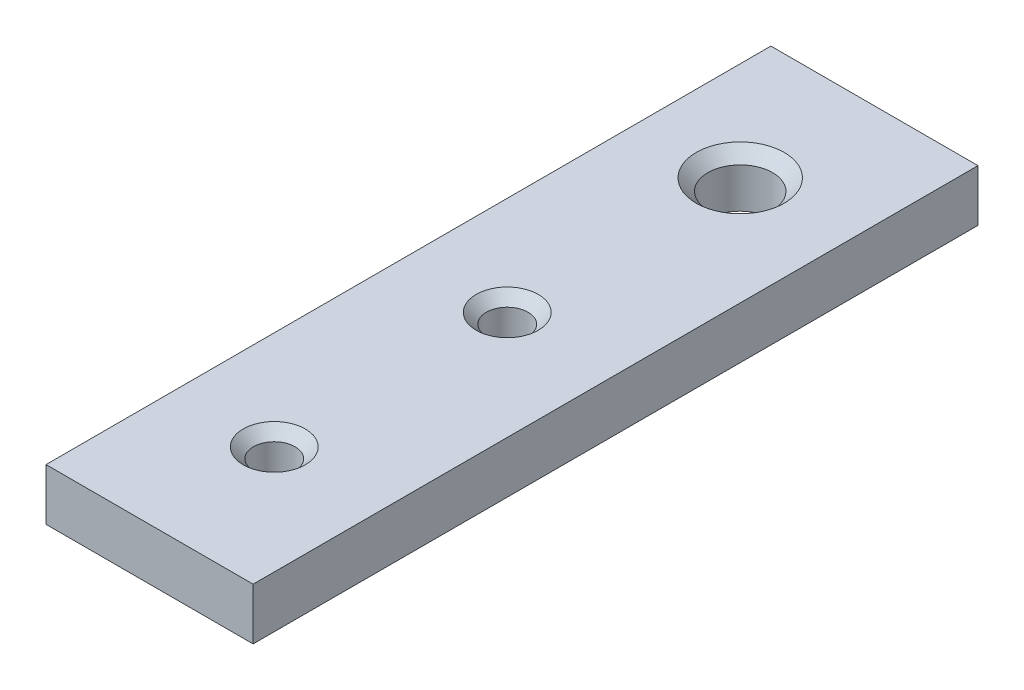
from build123d import *

# Parameters (mm, degrees)
SKETCH1_W                         = 25.4
SKETCH1_H                         = 88.9
BOSS_EXTRUDE1_DEPTH               = 6.35
F_1_4_20_TAPPED_HOLE1_D           = 5.1054
F_1_4_20_TAPPED_HOLE1_CSINK_D     = 7.62
F_1_4_20_TAPPED_HOLE1_CSINK_ANGLE = 90
F_3_8_16_TAPPED_HOLE1_D           = 7.9375
F_3_8_16_TAPPED_HOLE1_CSINK_D     = 10.795
F_3_8_16_TAPPED_HOLE1_CSINK_ANGLE = 90


with BuildPart() as part:
    # Sketch1 → Boss-Extrude1 (new body)
    with BuildSketch(Plane(origin=(0, 0, 0), x_dir=(1, 0, 0), z_dir=(0, 1, 0))):
        with Locations((-12.7, 44.45)):
            Rectangle(SKETCH1_W, SKETCH1_H)
    extrude(amount=BOSS_EXTRUDE1_DEPTH)

    # 1/4-20 Tapped Hole1 (through all)
    with Locations(Plane(origin=(0, 6.35, 0), x_dir=(1, 0, 0), z_dir=(0, 1, 0))):
        with Locations((-13.284419072, 15.875), (-13.284419072, 44.45)):
            CounterSinkHole(F_1_4_20_TAPPED_HOLE1_D / 2, F_1_4_20_TAPPED_HOLE1_CSINK_D / 2, counter_sink_angle=F_1_4_20_TAPPED_HOLE1_CSINK_ANGLE)

    # 3/8-16 Tapped Hole1 (through all)
    with Locations(Plane(origin=(0, 6.35, 0), x_dir=(1, 0, 0), z_dir=(0, 1, 0))):
        with Locations((-13.284419072, 73.025)):
            CounterSinkHole(F_3_8_16_TAPPED_HOLE1_D / 2, F_3_8_16_TAPPED_HOLE1_CSINK_D / 2, counter_sink_angle=F_3_8_16_TAPPED_HOLE1_CSINK_ANGLE)


solid = part.part
